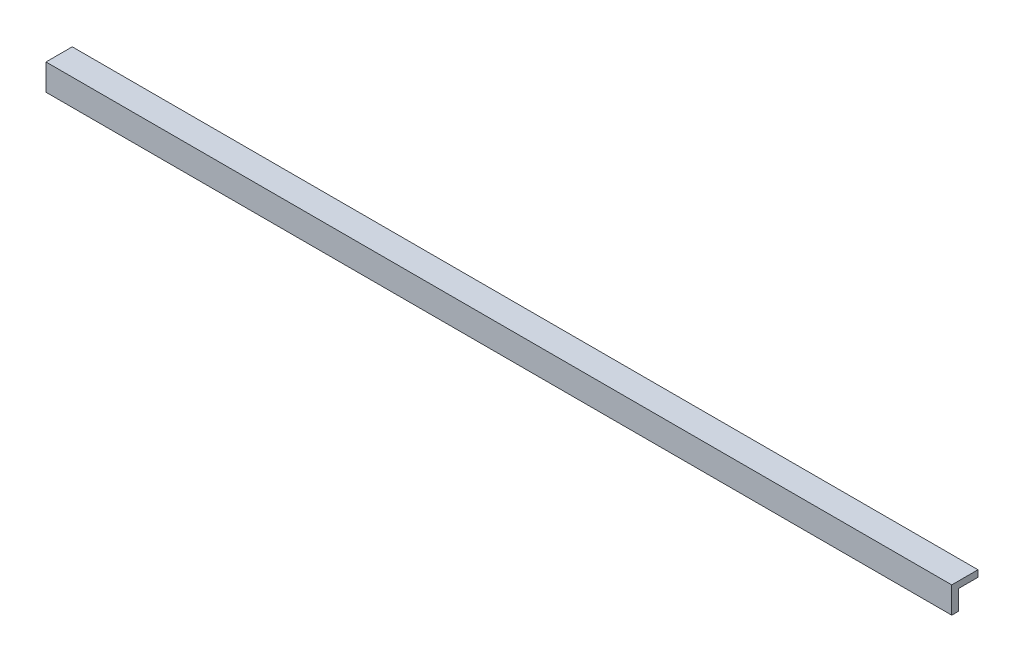
from build123d import *

# Parameters (mm, degrees)
BOSS_EXTRUDE1_DEPTH = 219.075


with BuildPart() as part:
    # Sketch1 → Boss-Extrude1 (new body)
    with BuildSketch(Plane(origin=(0, 0, 0), x_dir=(0, 0, -1), z_dir=(1, 0, 0))):
        Polygon((0, 0), (0, 6.35), (6.35, 6.35), (6.35, 4.7625), (1.5875, 4.7625), (1.5875, 0), align=None)
    extrude(amount=BOSS_EXTRUDE1_DEPTH)


solid = part.part
